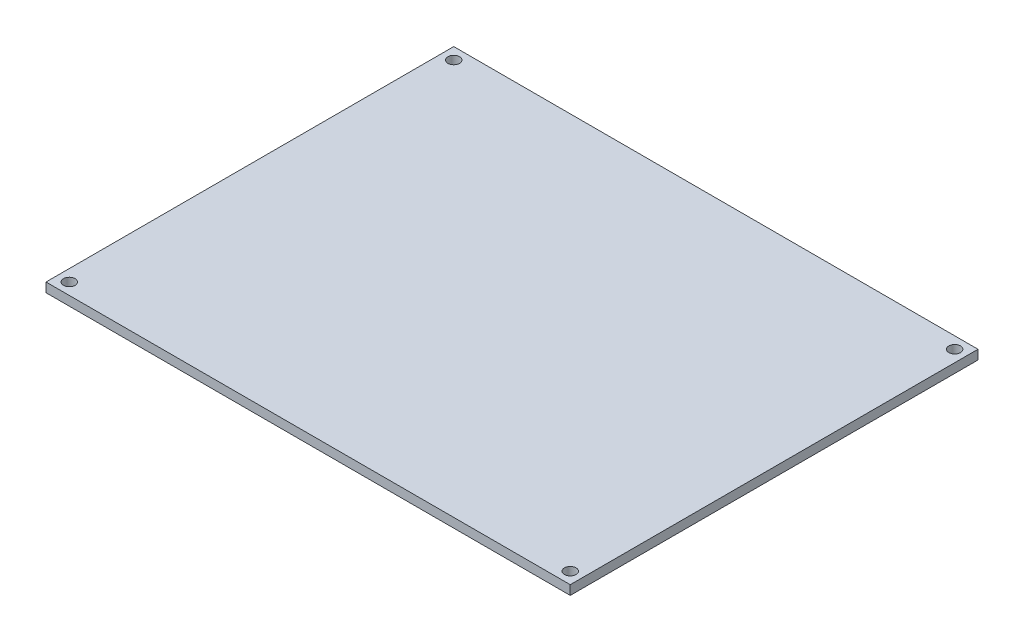
from build123d import *

# Parameters (mm, degrees)
SKETCH1_W           = 90
SKETCH1_H           = 70
SKETCH1_R           = 1
BOSS_EXTRUDE1_DEPTH = 1.6


with BuildPart() as part:
    # Sketch1 → Boss-Extrude1 (new body)
    with BuildSketch(Plane(origin=(0, 0, 0), x_dir=(1, 0, 0), z_dir=(0, 1, 0))):
        Rectangle(SKETCH1_W, SKETCH1_H)
        with Locations(Location((-43, 33, 0), (0, 0, 270))):
            Circle(SKETCH1_R, mode=Mode.SUBTRACT)
        with Locations(Location((43, 33, 0), (0, 0, 270))):
            Circle(SKETCH1_R, mode=Mode.SUBTRACT)
        with Locations(Location((-43, -33, 0), (0, 0, 270))):
            Circle(SKETCH1_R, mode=Mode.SUBTRACT)
        with Locations(Location((43, -33, 0), (0, 0, 270))):
            Circle(SKETCH1_R, mode=Mode.SUBTRACT)
    extrude(amount=BOSS_EXTRUDE1_DEPTH)


solid = part.part
